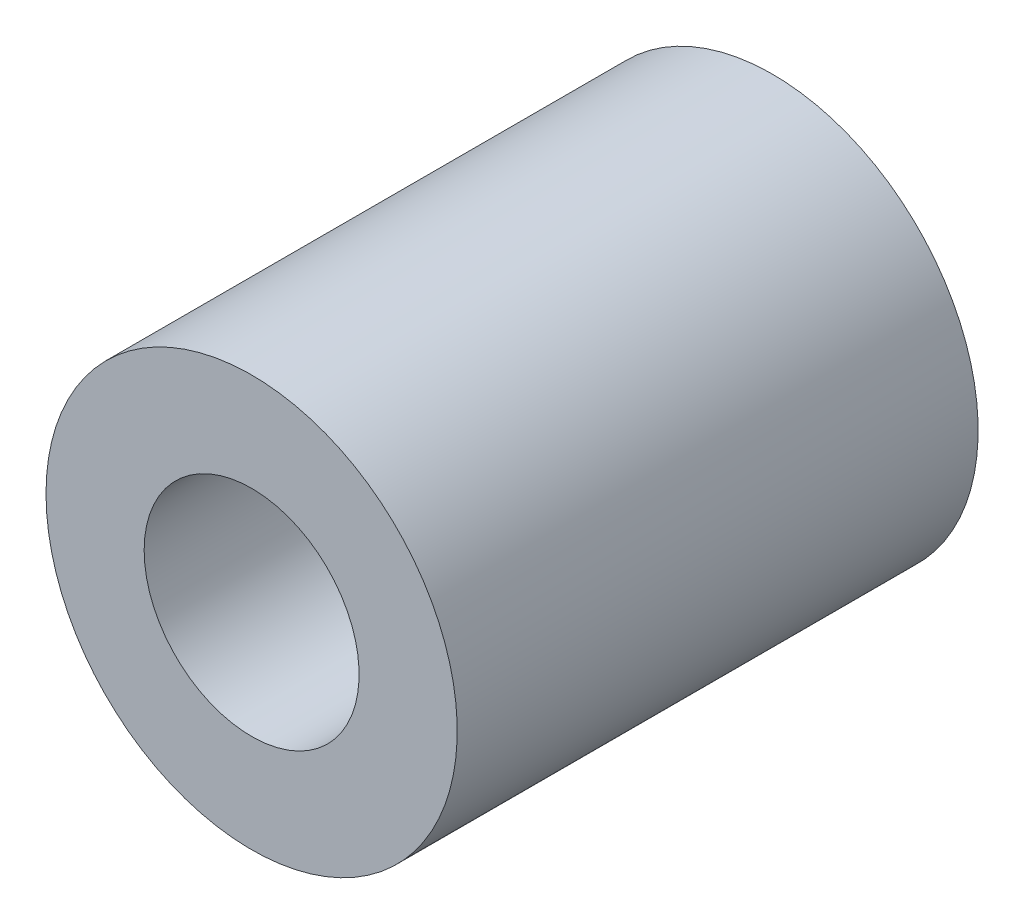
from build123d import *

# Parameters (mm, degrees)
SKETCH1_R           = 4.7625
SKETCH1_R_2         = 2.4892
BOSS_EXTRUDE1_DEPTH = 6.0325


with BuildPart() as part:
    # Sketch1 → Boss-Extrude1 (new, symmetric)
    with BuildSketch(Plane.XY):
        with Locations(Location((0, 0, 0), (0, 0, 180))):
            Circle(SKETCH1_R)
        with Locations(Location((0, 0, 0), (0, 0, 180))):
            Circle(SKETCH1_R_2, mode=Mode.SUBTRACT)
    extrude(amount=BOSS_EXTRUDE1_DEPTH, both=True)


solid = part.part
